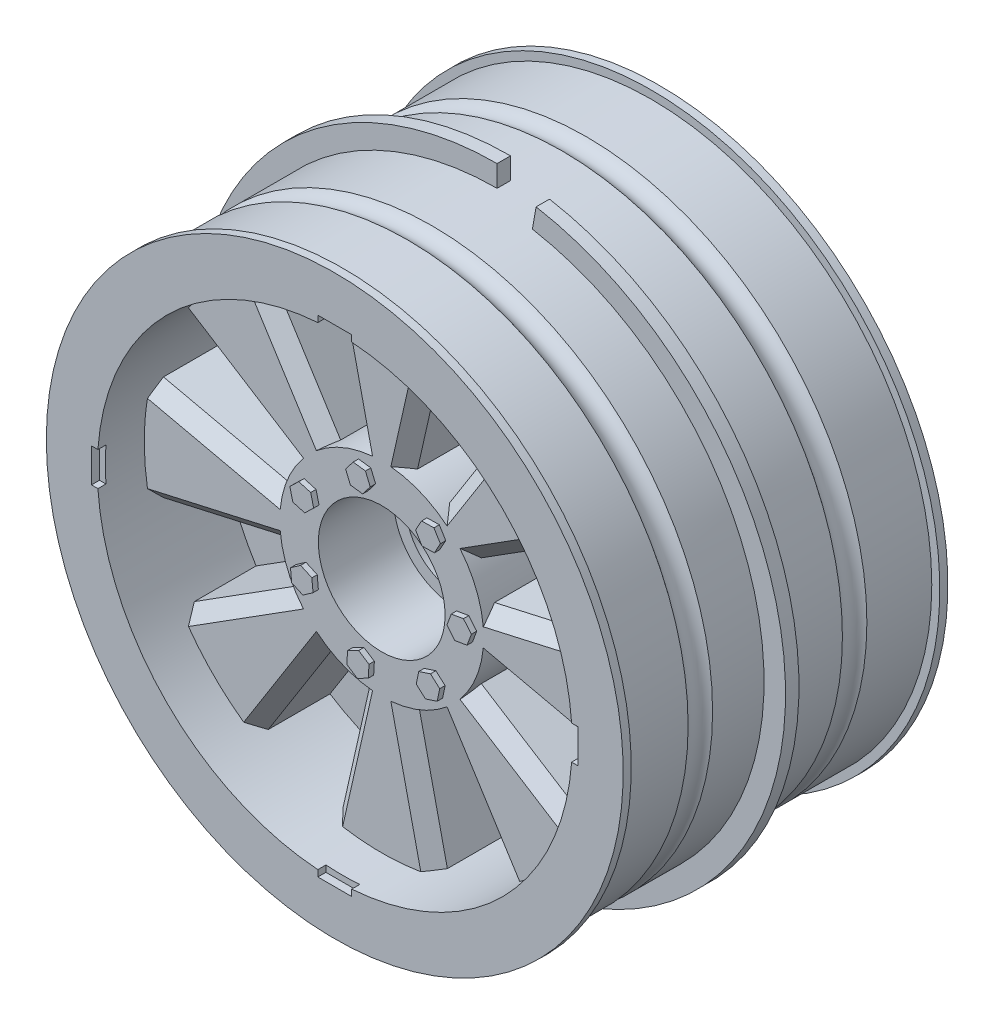
from build123d import *

# Parameters (mm, degrees)
SKETCH2_W           = 1.27
SKETCH2_H           = 2.032
REVOLVE2_ANGLE      = 90
SKETCH3_W           = 2.032
SKETCH3_H           = 1.27
REVOLVE3_ANGLE      = 80
SKETCH6_R           = 12.665625117
BOSS_EXTRUDE1_DEPTH = 24.892
SKETCH5_R           = 2.05
CUT_EXTRUDE1_DEPTH  = 53.848
BOSS_EXTRUDE3_START = 7.112
SKETCH8_R           = 6
BOSS_EXTRUDE3_DEPTH = 7.112
BOSS_EXTRUDE4_DEPTH = 0.508
CHAMFER1_SIZE       = 1.27
CHAMFER2_SIZE       = 1.27
SKETCH12_R          = 5.930903151
SKETCH12_R_2        = 2.05
BOSS_EXTRUDE5_DEPTH = 13.97
SKETCH13_R          = 4.831961825
CUT_EXTRUDE2_DEPTH  = 8.382
SKETCH7_R           = 15.117567398
SKETCH7_R_2         = 7.837467831
CUT_EXTRUDE3_DEPTH  = 9.906
FILLET1_R           = 2.54
SKETCH14_W          = 1.099193458
SKETCH14_H          = 3.202228848
SKETCH14_W_2        = 3.202228848
SKETCH14_H_2        = 1.099193458
CUT_EXTRUDE4_DEPTH  = 0.762


with BuildPart() as part:
    # Sketch1 → Revolve1 (revolve)
    with BuildSketch(Plane(origin=(0, 0, 0), x_dir=(0, 0, -1), z_dir=(1, 0, 0)), mode=Mode.PRIVATE) as revolve1_sk:
        with BuildLine():
            Line((-14.605, 26.543), (-8.46046161, 26.543))
            ThreePointArc((-8.46046161, 26.543), (-7.3025, 25.918811308), (-6.14453839, 26.543))
            Line((-6.14453839, 26.543), (6.14453839, 26.543))
            ThreePointArc((6.14453839, 26.543), (7.3025, 25.918811308), (8.46046161, 26.543))
            Line((8.46046161, 26.543), (14.605, 26.543))
            Line((14.605, 26.543), (14.605, 27.305))
            Line((14.605, 27.305), (15.367, 27.305))
            Line((15.367, 27.305), (15.367, 22.479))
            Line((15.367, 22.479), (3.81, 22.479))
            Line((3.81, 22.479), (3.81, 0))
            Line((3.81, 0), (-3.81, 0))
            Line((-3.81, 0), (-3.81, 22.479))
            Line((-3.81, 22.479), (-15.367, 22.479))
            Line((-15.367, 22.479), (-15.367, 27.305))
            Line((-15.367, 27.305), (-14.605, 27.305))
            Line((-14.605, 27.305), (-14.605, 26.543))
        make_face()
    revolve(revolve1_sk.sketch.rotate(Axis((0, 0, -33.180759494), (0, 0, 1)), 90), axis=Axis((0, 0, -33.180759494), (0, 0, 1)))

    # Sketch2 → Revolve2 (revolve)
    with BuildSketch(Plane(origin=(0, 0, 0), x_dir=(0, 0, -1), z_dir=(1, 0, 0))):
        with Locations((0.635, 27.559)):
            Rectangle(SKETCH2_W, SKETCH2_H)
    revolve2 = revolve(axis=Axis((0, 0, -24.112085438), (0, 0, 1)), revolution_arc=REVOLVE2_ANGLE)

    # Sketch3 → Revolve3 (revolve)
    with BuildSketch(Plane(origin=(0, 0, 0), x_dir=(1, 0, 0), z_dir=(0, 1, 0))):
        with Locations((27.559, -0.635)):
            Rectangle(SKETCH3_W, SKETCH3_H)
    revolve3 = revolve(axis=Axis((0, 0, -20.501312429), (0, 0, 1)), revolution_arc=REVOLVE3_ANGLE)

    # Mirror1: Revolve2, Revolve3 across plane
    add(revolve2.mirror(Plane.ZX))
    add(revolve3.mirror(Plane.ZX))

    # Sketch6 → Boss-Extrude1 (add)
    with BuildSketch(Plane(origin=(0, 0, -3.81), x_dir=(-1, 0, 0), z_dir=(0, 0, -1))):
        with Locations(Location((0, 0, 0), (0, 0, 180))):
            Circle(SKETCH6_R)
        Polygon((4.260442003, -5.463390334), (6.861655821, 0.957955839), (2.601213818, 6.421346173), (-4.260442003, 5.463390334), (-6.861655821, -0.957955839), (-2.601213818, -6.421346173), align=None, mode=Mode.SUBTRACT)
    extrude(amount=BOSS_EXTRUDE1_DEPTH)

    # Sketch5 → Cut-Extrude1 (cut)
    with BuildSketch(Plane.XY.offset(3.81)):
        Circle(SKETCH5_R)
    extrude(amount=-CUT_EXTRUDE1_DEPTH, mode=Mode.SUBTRACT)

    # Sketch8 → Boss-Extrude3 (add)
    with BuildSketch(Plane.XY.offset(3.81).offset(BOSS_EXTRUDE3_START)):
        with BuildLine():
            Line((2.122745348, 9.412936266), (4.945134196, 21.928317053))
            ThreePointArc((4.945134196, 21.928317053), (0, 22.479), (-4.945134196, 21.928317053))
            Line((-4.945134196, 21.928317053), (-2.122745348, 9.412936266))
            ThreePointArc((-2.122745348, 9.412936266), (-3.692635701, 8.91481119), (-5.154943434, 8.156958695))
            Line((-5.154943434, 8.156958695), (-12.008923765, 19.002399612))
            ThreePointArc((-12.008923765, 19.002399612), (-15.895053334, 15.895053334), (-19.002399612, 12.008923765))
            Line((-19.002399612, 12.008923765), (-8.156958695, 5.154943434))
            ThreePointArc((-8.156958695, 5.154943434), (-8.91481119, 3.692635701), (-9.412936266, 2.122745348))
            Line((-9.412936266, 2.122745348), (-21.928317053, 4.945134196))
            ThreePointArc((-21.928317053, 4.945134196), (-22.479, 0), (-21.928317053, -4.945134196))
            Line((-21.928317053, -4.945134196), (-9.412936266, -2.122745348))
            ThreePointArc((-9.412936266, -2.122745348), (-8.91481119, -3.692635701), (-8.156958695, -5.154943434))
            Line((-8.156958695, -5.154943434), (-19.002399612, -12.008923765))
            ThreePointArc((-19.002399612, -12.008923765), (-15.895053334, -15.895053334), (-12.008923765, -19.002399612))
            Line((-12.008923765, -19.002399612), (-5.154943434, -8.156958695))
            ThreePointArc((-5.154943434, -8.156958695), (-3.692635701, -8.91481119), (-2.122745348, -9.412936266))
            Line((-2.122745348, -9.412936266), (-4.945134196, -21.928317053))
            ThreePointArc((-4.945134196, -21.928317053), (0, -22.479), (4.945134196, -21.928317053))
            Line((4.945134196, -21.928317053), (2.122745348, -9.412936266))
            ThreePointArc((2.122745348, -9.412936266), (3.692635701, -8.91481119), (5.154943434, -8.156958695))
            Line((5.154943434, -8.156958695), (12.008923765, -19.002399612))
            ThreePointArc((12.008923765, -19.002399612), (15.895053334, -15.895053334), (19.002399612, -12.008923765))
            Line((19.002399612, -12.008923765), (8.156958695, -5.154943434))
            ThreePointArc((8.156958695, -5.154943434), (8.91481119, -3.692635701), (9.412936266, -2.122745348))
            Line((9.412936266, -2.122745348), (21.928317053, -4.945134196))
            ThreePointArc((21.928317053, -4.945134196), (22.479, 0), (21.928317053, 4.945134196))
            Line((21.928317053, 4.945134196), (9.412936266, 2.122745348))
            ThreePointArc((9.412936266, 2.122745348), (8.91481119, 3.692635701), (8.156958695, 5.154943434))
            Line((8.156958695, 5.154943434), (19.002399612, 12.008923765))
            ThreePointArc((19.002399612, 12.008923765), (15.895053334, 15.895053334), (12.008923765, 19.002399612))
            Line((12.008923765, 19.002399612), (5.154943434, 8.156958695))
            ThreePointArc((5.154943434, 8.156958695), (3.692635701, 8.91481119), (2.122745348, 9.412936266))
        make_face()
        Circle(SKETCH8_R, mode=Mode.SUBTRACT)
    extrude(amount=-BOSS_EXTRUDE3_DEPTH)

    # Sketch9 → Boss-Extrude4 (add)
    with BuildSketch(Plane.XY.offset(10.922)):
        Polygon((4.647607947, -7.276157818), (5.76179296, -6.908825419), (6.000766278, -5.760246695), (5.125554583, -4.979000368), (4.01136957, -5.346332766), (3.772396252, -6.494911491), align=None)
        Polygon((8.586465411, -0.902963985), (8.993956371, 0.197168939), (8.24495879, 1.100132924), (7.088470251, 0.902963985), (6.680979291, -0.197168939), (7.429976871, -1.100132924), align=None)
        Polygon((-2.790993095, -8.170256407), (-1.809118069, -8.812333323), (-0.762125635, -8.283043065), (-0.697008228, -7.111675891), (-1.678883254, -6.469598975), (-2.725875688, -6.998889233), align=None)
        Polygon((-8.127919411, -2.911985279), (-8.017726292, -4.079974496), (-6.9511214, -4.568539064), (-5.994709627, -3.889114416), (-6.104902745, -2.7211252), (-7.171507637, -2.232560631), align=None)
        Polygon((-7.344356631, 4.539070158), (-8.188823086, 3.724688343), (-7.905780974, 2.586168033), (-6.778272407, 2.262029538), (-5.933805952, 3.076411352), (-6.216848064, 4.214931662), align=None)
        Polygon((-1.03034351, 8.572113186), (-2.193569074, 8.72458489), (-2.907226226, 7.793437854), (-2.457657813, 6.709819113), (-1.294432249, 6.557347408), (-0.580775098, 7.488494445), align=None)
        Polygon((6.059539289, 6.150180146), (5.453487191, 7.154691065), (4.280529167, 7.132090013), (3.713623241, 6.10497804), (4.319675339, 5.10046712), (5.492633363, 5.123068173), align=None)
    extrude(amount=BOSS_EXTRUDE4_DEPTH)

    # Chamfer1
    chamfer1_edges = [part.edges().sort_by_distance(p)[0] for p in [
        (13.579679153, 8.5819336, 10.922),
    ]]
    chamfer(chamfer1_edges, length=CHAMFER1_SIZE)

    # Chamfer2
    chamfer2_edges = [part.edges().sort_by_distance(p)[0] for p in [
        (3.533939772, 15.67062666, 10.922),
        (-3.533939772, 15.67062666, 10.922),
        (-8.5819336, 13.579679153, 10.922),
        (-13.579679153, 8.5819336, 10.922),
        (-15.67062666, 3.533939772, 10.922),
        (-15.67062666, -3.533939772, 10.922),
        (-13.579679153, -8.5819336, 10.922),
        (-8.5819336, -13.579679153, 10.922),
        (-3.533939772, -15.67062666, 10.922),
        (3.533939772, -15.67062666, 10.922),
        (8.5819336, -13.579679153, 10.922),
        (13.579679153, -8.5819336, 10.922),
        (15.67062666, -3.533939772, 10.922),
        (15.67062666, 3.533939772, 10.922),
        (8.5819336, 13.579679153, 10.922),
    ]]
    chamfer(chamfer2_edges, length=CHAMFER2_SIZE)

    # Sketch12 → Boss-Extrude5 (add)
    with BuildSketch(Plane(origin=(0, 0, -3.81), x_dir=(-1, 0, 0), z_dir=(0, 0, -1))):
        with Locations(Location((0, 0, 0), (0, 0, 180))):
            Circle(SKETCH12_R)
        with Locations(Location((0, 0, 0), (0, 0, 180))):
            Circle(SKETCH12_R_2, mode=Mode.SUBTRACT)
    extrude(amount=BOSS_EXTRUDE5_DEPTH)

    # Sketch13 → Cut-Extrude2 (cut)
    with BuildSketch(Plane.XY.offset(3.81)):
        Circle(SKETCH13_R)
    extrude(amount=-CUT_EXTRUDE2_DEPTH, mode=Mode.SUBTRACT)

    # Sketch7 → Cut-Extrude3 (cut)
    with BuildSketch(Plane(origin=(0, 0, -28.702), x_dir=(-1, 0, 0), z_dir=(0, 0, -1))):
        Circle(SKETCH7_R)
        Circle(SKETCH7_R_2, mode=Mode.SUBTRACT)
    extrude(amount=-CUT_EXTRUDE3_DEPTH, mode=Mode.SUBTRACT)

    # Fillet1
    fillet1_edges = [part.edges().sort_by_distance(p)[0] for p in [
        (7.837467831, 0, -18.796),
    ]]
    fillet(fillet1_edges, radius=FILLET1_R)

    # Sketch14 → Cut-Extrude4 (cut)
    with BuildSketch(Plane.XY.offset(15.367)):
        with Locations((22.479, 0)):
            Rectangle(SKETCH14_W, SKETCH14_H)
        with Locations((0, 22.479)):
            Rectangle(SKETCH14_W_2, SKETCH14_H_2)
        with Locations((0, -22.479)):
            Rectangle(SKETCH14_W_2, SKETCH14_H_2)
        with Locations((-22.479, 0)):
            Rectangle(SKETCH14_W, SKETCH14_H)
    extrude(amount=-CUT_EXTRUDE4_DEPTH, mode=Mode.SUBTRACT)


solid = part.part
